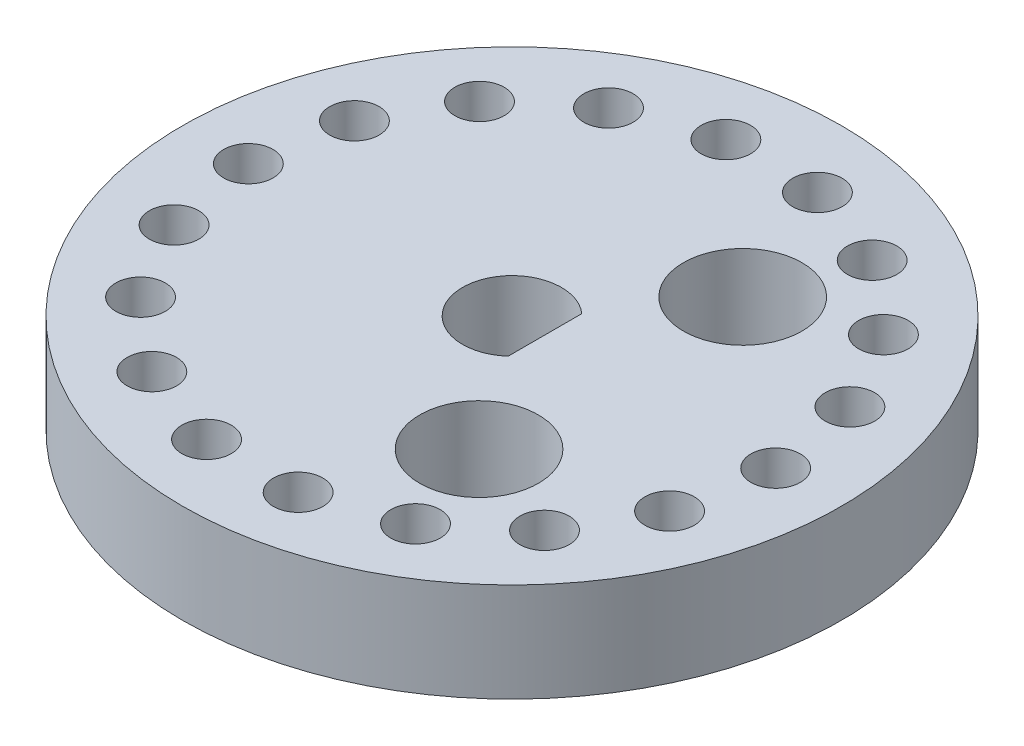
from build123d import *

# Parameters (mm, degrees)
SKETCH_1_R          = 10
EXTRUDE_1_DEPTH     = 3
SKETCH_3_R          = 0.75
CUT_EXTRUDE_2_DEPTH = 15.456832295
SKETCH_4_R          = 1.8
CUT_EXTRUDE_3_DEPTH = 15.456832295
CUT_EXTRUDE_6_REACH = 16.457


with BuildPart() as part:
    # 草图1 → 凸台-拉伸1 (new body)
    with BuildSketch(Plane(origin=(0, 0, 0), x_dir=(1, 0, 0), z_dir=(0, 1, 0))):
        with Locations(Location((0, 0, 0), (0, 0, 270))):
            Circle(SKETCH_1_R)
    extrude(amount=EXTRUDE_1_DEPTH)

    # 草图3 → 切除-拉伸2 (cut, through all)
    with BuildSketch(Plane(origin=(0, 3, 0), x_dir=(1, 0, 0), z_dir=(0, 1, 0))):
        with Locations(Location((8, 0, 0), (0, 0, 270))):
            Circle(SKETCH_3_R)
        with Locations(Location((7.517540966, -2.736161147, 0), (0, 0, 270))):
            Circle(SKETCH_3_R)
        with Locations(Location((6.128355545, -5.142300877, 0), (0, 0, 270))):
            Circle(SKETCH_3_R)
        with Locations(Location((4, -6.92820323, 0), (0, 0, 270))):
            Circle(SKETCH_3_R)
        with Locations(Location((1.389185421, -7.878462024, 0), (0, 0, 270))):
            Circle(SKETCH_3_R)
        with Locations(Location((-1.389185421, -7.878462024, 0), (0, 0, 270))):
            Circle(SKETCH_3_R)
        with Locations(Location((-4, -6.92820323, 0), (0, 0, 270))):
            Circle(SKETCH_3_R)
        with Locations(Location((-6.128355545, -5.142300877, 0), (0, 0, 270))):
            Circle(SKETCH_3_R)
        with Locations(Location((-7.517540966, -2.736161147, 0), (0, 0, 270))):
            Circle(SKETCH_3_R)
        with Locations(Location((-8, 0, 0), (0, 0, 270))):
            Circle(SKETCH_3_R)
        with Locations(Location((-7.517540966, 2.736161147, 0), (0, 0, 270))):
            Circle(SKETCH_3_R)
        with Locations(Location((-6.128355545, 5.142300877, 0), (0, 0, 270))):
            Circle(SKETCH_3_R)
        with Locations(Location((-4, 6.92820323, 0), (0, 0, 270))):
            Circle(SKETCH_3_R)
        with Locations(Location((-1.389185421, 7.878462024, 0), (0, 0, 270))):
            Circle(SKETCH_3_R)
        with Locations(Location((1.389185421, 7.878462024, 0), (0, 0, 270))):
            Circle(SKETCH_3_R)
        with Locations(Location((4, 6.92820323, 0), (0, 0, 270))):
            Circle(SKETCH_3_R)
        with Locations(Location((6.128355545, 5.142300877, 0), (0, 0, 270))):
            Circle(SKETCH_3_R)
        with Locations(Location((7.517540966, 2.736161147, 0), (0, 0, 270))):
            Circle(SKETCH_3_R)
    extrude(amount=-CUT_EXTRUDE_2_DEPTH, mode=Mode.SUBTRACT)

    # 草图4 → 切除-拉伸3 (cut, through all)
    with BuildSketch(Plane(origin=(0, 3, 0), x_dir=(1, 0, 0), z_dir=(0, 1, 0))):
        with Locations(Location((3, -4, 0), (0, 0, 270))):
            Circle(SKETCH_4_R)
        with Locations(Location((3, 4, 0), (0, 0, 90))):
            Circle(SKETCH_4_R)
    extrude(amount=-CUT_EXTRUDE_3_DEPTH, mode=Mode.SUBTRACT)

    # 草图2 → 切除-拉伸6 (cut, up to next)
    with BuildSketch(Plane(origin=(0, 3, 0), x_dir=(1, 0, 0), z_dir=(0, 1, 0)), mode=Mode.PRIVATE) as cut_extrude_6_sk1:
        with BuildLine():
            Line((1, 1.118033989), (1, -1.118033989))
            ThreePointArc((1, -1.118033989), (-1.5, 0), (1, 1.118033989))
        make_face()
    cut_extrude_6_tool1 = extrude(cut_extrude_6_sk1.sketch, amount=-CUT_EXTRUDE_6_REACH, mode=Mode.PRIVATE) & part.part
    add(cut_extrude_6_tool1.solids().sort_by_distance((-0.148024, 3, 0))[0], mode=Mode.SUBTRACT)


solid = part.part
